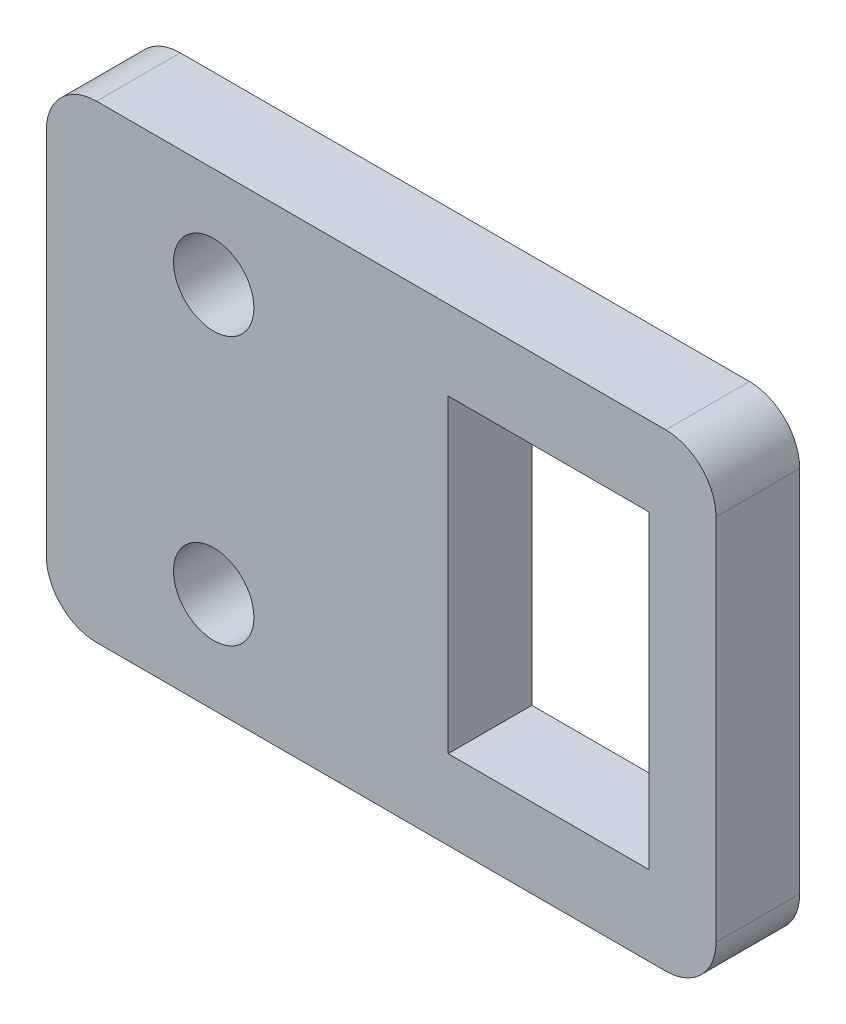
from build123d import *

# Parameters (mm, degrees)
SKETCH1_W           = 40
SKETCH1_H           = 28
SKETCH1_R           = 2.4
SKETCH1_W_2         = 12
SKETCH1_H_2         = 18.5
BOSS_EXTRUDE1_DEPTH = 5
FILLET1_R           = 3


with BuildPart() as part:
    # Sketch1 → Boss-Extrude1 (new body)
    with BuildSketch(Plane.XY):
        Rectangle(SKETCH1_W, SKETCH1_H)
        with Locations((-10, 8)):
            Circle(SKETCH1_R, mode=Mode.SUBTRACT)
        with Locations((-10, -8)):
            Circle(SKETCH1_R, mode=Mode.SUBTRACT)
        with Locations((10, 0)):
            Rectangle(SKETCH1_W_2, SKETCH1_H_2, mode=Mode.SUBTRACT)
    extrude(amount=BOSS_EXTRUDE1_DEPTH)

    # Fillet1
    fillet1_edges = [part.edges().sort_by_distance(p)[0] for p in [
        (20, -14, 2.5),
        (-20, -14, 2.5),
        (-20, 14, 2.5),
        (20, 14, 2.5),
    ]]
    fillet(fillet1_edges, radius=FILLET1_R)


solid = part.part
